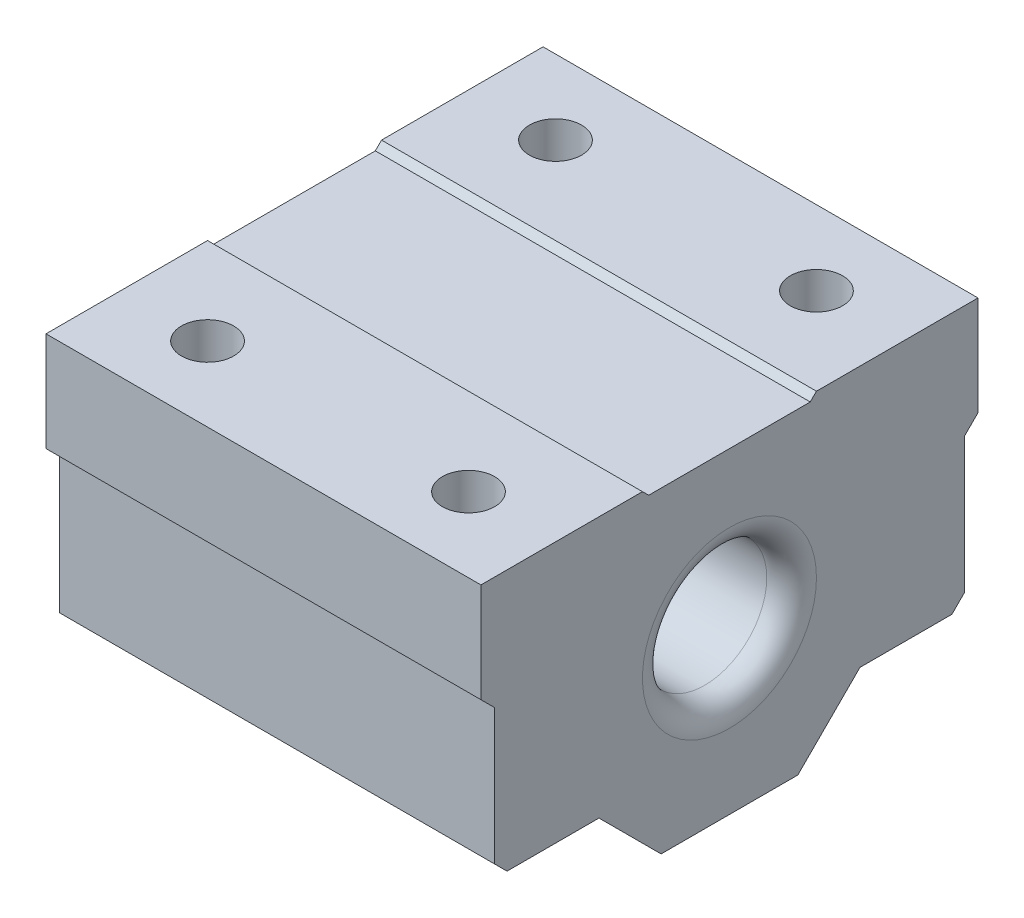
from build123d import *

# Parameters (mm, degrees)
SKETCH1_R             = 5
BOSS_EXTRUDE1_DEPTH   = 35
M5_TAPPED_HOLE1_D     = 4.2
M5_TAPPED_HOLE1_DEPTH = 22
M5_TAPPED_HOLE1_TIP   = 1.2618073
CHAMFER1_SIZE         = 1
FILLET1_R             = 2


with BuildPart() as part:
    # Sketch1 → Boss-Extrude1 (new body)
    with BuildSketch(Plane(origin=(0, 0, 0), x_dir=(0, 0, -1), z_dir=(1, 0, 0))):
        Polygon((0, 18), (1.1, 16.9), (1.1, 6), (2.1, 5), (9.5, 5), (14.5, 0), (25.5, 0), (30.5, 5), (37.9, 5), (38.9, 6), (38.9, 16.9), (40, 18), (40, 26), (27, 26), (26.5, 25.5), (20, 25.5), (13.5, 25.5), (13, 26), (0, 26), align=None)
        with Locations((20, 13)):
            Circle(SKETCH1_R, mode=Mode.SUBTRACT)
    extrude(amount=BOSS_EXTRUDE1_DEPTH)

    # M5 Tapped Hole1
    with Locations(Plane(origin=(7, 26, -34), x_dir=(0, 0, 1), z_dir=(0, 1, 0))):
        with Locations((0, 0), (0, 21), (28, 21), (28, 0)):
            Hole(M5_TAPPED_HOLE1_D / 2, depth=M5_TAPPED_HOLE1_DEPTH)
            with Locations((0, 0, -(M5_TAPPED_HOLE1_DEPTH + M5_TAPPED_HOLE1_TIP / 2))):  # 118° drill point
                Cone(0, M5_TAPPED_HOLE1_D / 2, M5_TAPPED_HOLE1_TIP, mode=Mode.SUBTRACT)

    # Chamfer1
    chamfer1_edges = [part.edges().sort_by_distance(p)[0] for p in [
        (7, 5, -3.9),
        (28, 5, -3.9),
        (28, 5, -31.9),
        (7, 5, -31.9),
    ]]
    chamfer(chamfer1_edges, length=CHAMFER1_SIZE)

    # Fillet1
    fillet1_edges = [part.edges().sort_by_distance(p)[0] for p in [
        (0, 13, -15),
        (35, 13, -15),
    ]]
    fillet(fillet1_edges, radius=FILLET1_R)


solid = part.part
